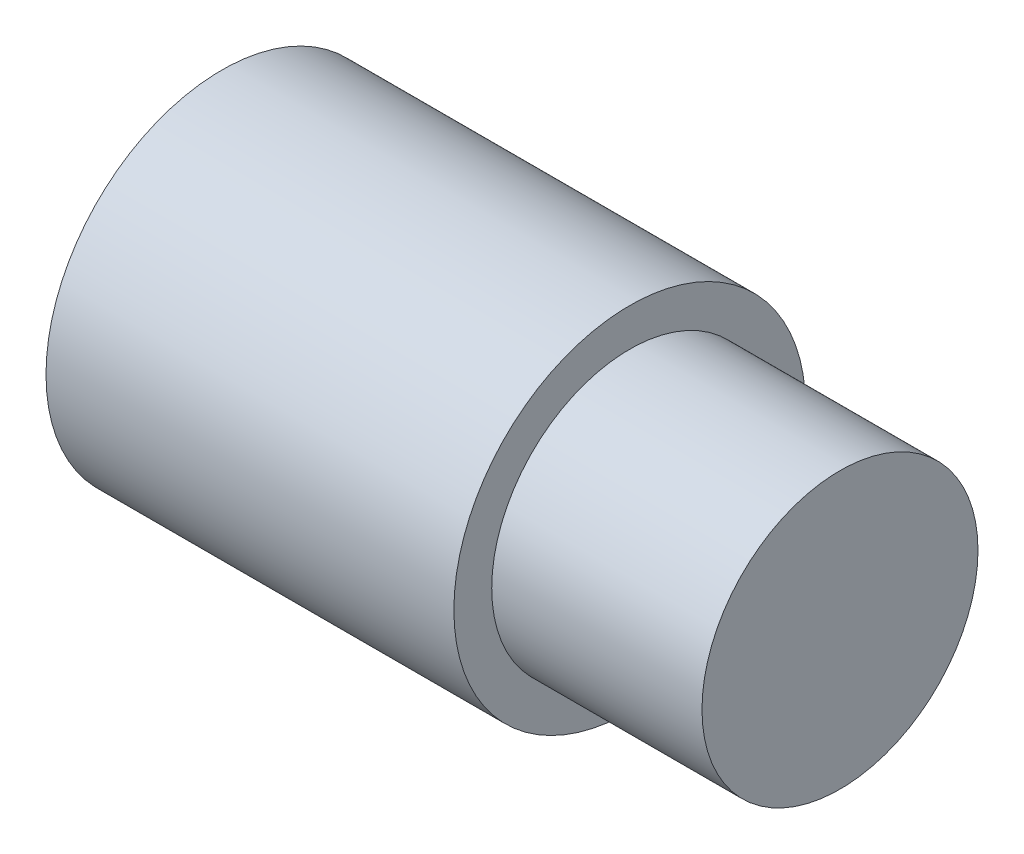
from build123d import *

# Parameters (mm, degrees)
SOCKET_SKETCH_W = 17.8
SOCKET_SKETCH_H = 4.7625


with BuildPart() as part:
    # Conn_T6_ORB8 Sketch → Conn_T6_ORB8 (revolve)
    with BuildSketch(Plane.XY):
        Polygon((13.3, 0), (13.3, 8.73), (0, 8.73), (0, 11.124), (-25.8, 11.124), (-25.8, 0), align=None)
    revolve(axis=Axis((-1000, 0, 0), (1, 0, 0)))

    # Socket Sketch → Socket (revolve, cut)
    with BuildSketch(Plane.XY):
        with Locations((-17.9, 2.38125)):
            Rectangle(SOCKET_SKETCH_W, SOCKET_SKETCH_H)
    revolve(axis=Axis((-1000, 0, 0), (1, 0, 0)), mode=Mode.SUBTRACT)


solid = part.part
